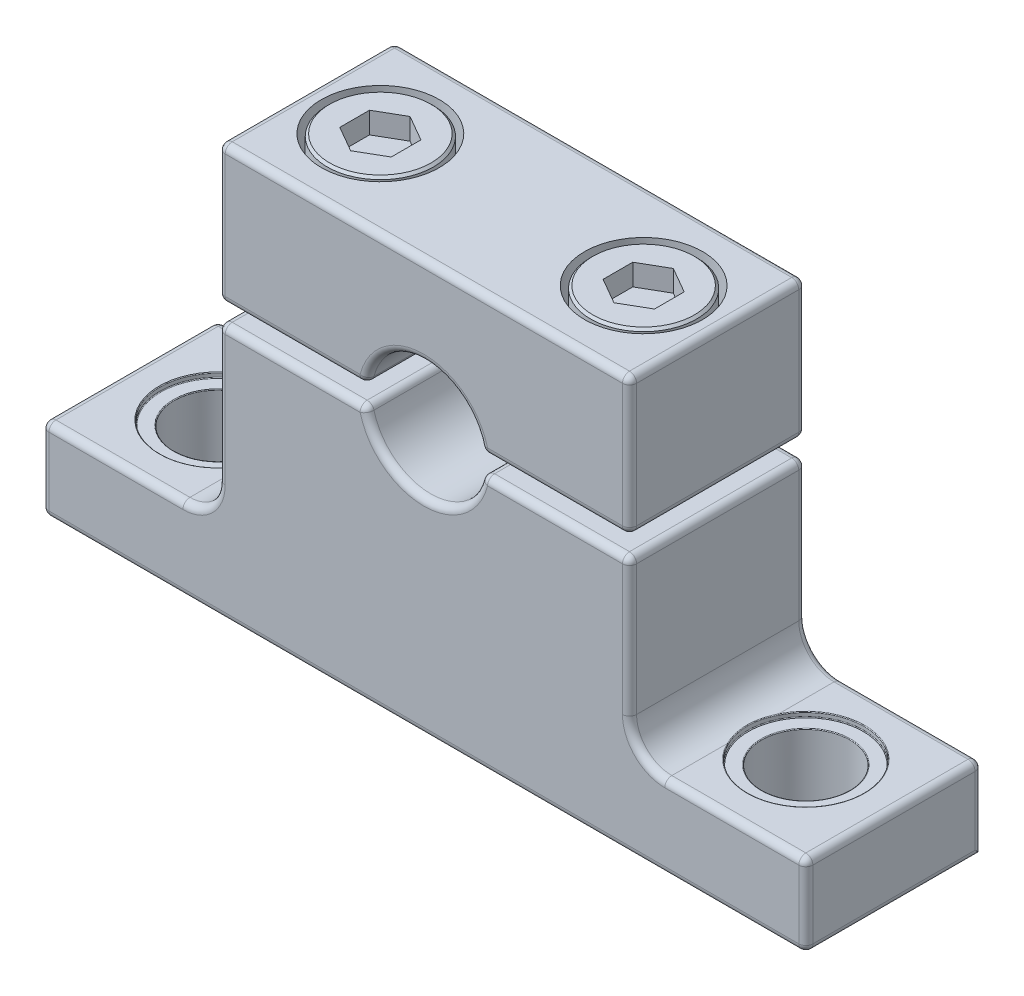
from build123d import *

# Parameters (mm, degrees)
BOSS_EXTRUDE1_DEPTH   = 9.525
BOSS_EXTRUDE1_2_DEPTH = 9.525
SKETCH4_R             = 2.38125
CUT_EXTRUDE1_DEPTH    = 32.789662726
SKETCH8_R             = 3.14325
CUT_EXTRUDE3_DEPTH    = 9.5885
SKETCH10_R            = 2.0066
CUT_EXTRUDE4_DEPTH    = 32.789662756
SKETCH12_R            = 3.1877
CUT_EXTRUDE5_DEPTH    = 3.8862
CHAMFER1_SIZE         = 0.127
CUT_EXTRUDE6_DEPTH    = 1.156716
FILLET1_R             = 0.381
FILLET2_R             = 0.381
FILLET3_R             = 0.0381


with BuildPart() as part:
    # Sketch3 → Boss-Extrude1 (new body)
    with BuildSketch(Plane.XY):
        with BuildLine():
            Line((-11.1125, 22.225), (11.1125, 22.225))
            Line((11.1125, 22.225), (11.1125, 14.7955))
            Line((11.1125, 14.7955), (3.134096521, 14.7955))
            ThreePointArc((3.134096521, 14.7955), (0, 17.4625), (-3.134096521, 14.7955))
            Line((-3.134096521, 14.7955), (-11.1125, 14.7955))
            Line((-11.1125, 14.7955), (-11.1125, 22.225))
        make_face()
    extrude(amount=-BOSS_EXTRUDE1_DEPTH)


with BuildPart() as body_2:
    # Sketch3 → Boss-Extrude1 2 (new body)
    with BuildSketch(Plane.XY):
        with BuildLine():
            Line((-11.1125, 13.7795), (-11.1125, 6.35))
            ThreePointArc((-11.1125, 6.35), (-11.670461582, 5.002961582), (-13.0175, 4.445))
            Line((-13.0175, 4.445), (-20.6375, 4.445))
            Line((-20.6375, 4.445), (-20.6375, 0))
            Line((-20.6375, 0), (20.6375, 0))
            Line((20.6375, 0), (20.6375, 4.445))
            Line((20.6375, 4.445), (13.0175, 4.445))
            ThreePointArc((13.0175, 4.445), (11.670461582, 5.002961582), (11.1125, 6.35))
            Line((11.1125, 6.35), (11.1125, 13.7795))
            Line((11.1125, 13.7795), (3.134096521, 13.7795))
            ThreePointArc((3.134096521, 13.7795), (0, 11.1125), (-3.134096521, 13.7795))
            Line((-3.134096521, 13.7795), (-11.1125, 13.7795))
        make_face()
    extrude(amount=-BOSS_EXTRUDE1_2_DEPTH)

    # Sketch4 → Cut-Extrude1 (cut, through all)
    with BuildSketch(Plane.XZ):
        with Locations((-15.875, -4.7625)):
            Circle(SKETCH4_R)
        with Locations(Location((15.875, -4.7625, 0), (0, 0, 180))):
            Circle(SKETCH4_R)
    extrude(amount=-CUT_EXTRUDE1_DEPTH, mode=Mode.SUBTRACT)

    # Sketch8 → Cut-Extrude3 (cut)
    with BuildSketch(Plane(origin=(0, 13.7795, 0), x_dir=(1, 0, 0), z_dir=(0, 1, 0))):
        with Locations(Location((-15.875, 4.7625, 0), (0, 0, 180))):
            Circle(SKETCH8_R)
        with Locations(Location((15.875, 4.7625, 0), (0, 0, 155.380022671))):
            Circle(SKETCH8_R)
    extrude(amount=-CUT_EXTRUDE3_DEPTH, mode=Mode.SUBTRACT)


with BuildPart() as cut_extrude4_tool:
    # Sketch10 → Cut-Extrude4 (new, through all)
    with BuildSketch(Plane(origin=(0, 22.225, 0), x_dir=(1, 0, 0), z_dir=(0, 1, 0))):
        with Locations(Location((7.112, 4.7625, 0), (0, 0, 180))):
            Circle(SKETCH10_R)
        with Locations(Location((-7.112, 4.7625, 0), (0, 0, 180))):
            Circle(SKETCH10_R)
    extrude(amount=-CUT_EXTRUDE4_DEPTH)


with BuildPart() as part_1:
    add(part.part)

    # Cut-Extrude4: cut by cut_extrude4_tool
    add(cut_extrude4_tool.part, mode=Mode.SUBTRACT)

    # Sketch12 → Cut-Extrude5 (cut)
    with BuildSketch(Plane(origin=(0, 22.225, 0), x_dir=(1, 0, 0), z_dir=(0, 1, 0))):
        with Locations(Location((7.112, 4.7625, 0), (0, 0, 180))):
            Circle(SKETCH12_R)
        with Locations(Location((-7.112, 4.7625, 0), (0, 0, 180))):
            Circle(SKETCH12_R)
    extrude(amount=-CUT_EXTRUDE5_DEPTH, mode=Mode.SUBTRACT)

    # Fillet1
    fillet1_edges = [part_1.edges().sort_by_distance(p)[0] for p in [
        (0, 17.4625, -9.525),
        (-11.1125, 22.225, -4.7625),
        (11.1125, 22.225, -4.7625),
        (11.1125, 14.7955, -4.7625),
        (3.134096521, 14.7955, -4.7625),
        (-3.134096521, 14.7955, -4.7625),
        (-11.1125, 14.7955, -4.7625),
        (7.12329826, 14.7955, -9.525),
        (11.1125, 18.51025, -9.525),
        (0, 22.225, -9.525),
        (-11.1125, 18.51025, -9.525),
        (0, 22.225, 0),
        (11.1125, 18.51025, 0),
        (7.12329826, 14.7955, 0),
        (-7.12329826, 14.7955, -9.525),
        (0, 17.4625, 0),
        (-7.12329826, 14.7955, 0),
        (-11.1125, 18.51025, 0),
    ]]
    fillet(fillet1_edges, radius=FILLET1_R)


with BuildPart() as body_2_1:
    add(body_2.part)

    # Cut-Extrude4: cut by cut_extrude4_tool
    add(cut_extrude4_tool.part, mode=Mode.SUBTRACT)

    # Fillet2
    fillet2_edges = [body_2_1.edges().sort_by_distance(p)[0] for p in [
        (-11.670461582, 5.002961582, -9.525),
        (0, 11.1125, 0),
        (7.12329826, 13.7795, 0),
        (11.1125, 10.06475, 0),
        (11.670461582, 5.002961582, 0),
        (16.8275, 4.445, 0),
        (20.6375, 2.2225, 0),
        (-16.8275, 4.445, -9.525),
        (0, 0, 0),
        (-20.6375, 2.2225, 0),
        (-16.8275, 4.445, 0),
        (-11.670461582, 5.002961582, 0),
        (-11.1125, 10.06475, 0),
        (-7.12329826, 13.7795, 0),
        (-20.6375, 2.2225, -9.525),
        (-3.134096521, 13.7795, -4.7625),
        (3.134096521, 13.7795, -4.7625),
        (11.1125, 13.7795, -4.7625),
        (20.6375, 4.445, -4.7625),
        (20.6375, 0, -4.7625),
        (-20.6375, 0, -4.7625),
        (-20.6375, 4.445, -4.7625),
        (-11.1125, 13.7795, -4.7625),
        (20.6375, 2.2225, -9.525),
        (16.8275, 4.445, -9.525),
        (11.670461582, 5.002961582, -9.525),
        (11.1125, 10.06475, -9.525),
        (7.12329826, 13.7795, -9.525),
        (0, 11.1125, -9.525),
        (-7.12329826, 13.7795, -9.525),
        (-11.1125, 10.06475, -9.525),
    ]]
    fillet(fillet2_edges, radius=FILLET2_R)

    # Fillet3
    fillet3_edges = [body_2_1.edges().sort_by_distance(p)[0] for p in [
        (-12.73175, 4.466553176, -4.7625),
        (-16.545143152, 4.445, -1.691518281),
        (-12.73175, 4.191, -4.7625),
        (-18.25625, 4.191, -4.7625),
        (19.01825, 4.445, -4.7625),
        (12.73175, 4.466553176, -4.7625),
        (18.25625, 4.191, -4.7625),
        (18.7325, 4.191, -3.453028995),
    ]]
    fillet(fillet3_edges, radius=FILLET3_R)


with BuildPart() as body_3:
    # Sketch15 → Revolve1 (revolve)
    with BuildSketch(Plane.XY.offset(-4.7625), mode=Mode.PRIVATE) as revolve1_sk:
        Polygon((-7.112, 4.191), (-7.112, 22.225), (-9.9822, 22.225), (-9.9822, 18.7198), (-8.8646, 18.7198), (-8.8646, 4.191), align=None)
    revolve(revolve1_sk.sketch.rotate(Axis((-7.112, 4.191, -4.7625), (0, 1, 0)), 180), axis=Axis((-7.112, 4.191, -4.7625), (0, 1, 0)))

    # Chamfer1
    chamfer1_edges = [body_3.edges().sort_by_distance(p)[0] for p in [
        (-9.9822, 22.225, -4.7625),
    ]]
    chamfer(chamfer1_edges, length=CHAMFER1_SIZE)

    # Sketch16 → Cut-Extrude6 (cut)
    with BuildSketch(Plane(origin=(0, 22.225, 0), x_dir=(1, 0, 0), z_dir=(0, 1, 0))):
        Polygon((-7.112, 6.366451217), (-8.5010625, 5.564475608), (-8.5010625, 3.960524392), (-7.112, 3.158548783), (-5.7229375, 3.960524392), (-5.7229375, 5.564475608), align=None)
    extrude(amount=-CUT_EXTRUDE6_DEPTH, mode=Mode.SUBTRACT)


with BuildPart() as body_4:
    # Mirror1: mirrored copy
    add(body_3.part.mirror(Plane(origin=(0, 0, 0), x_dir=(0, 0, 1), z_dir=(1, 0, 0))))


solid = Compound([part_1.part, body_2_1.part, body_3.part, body_4.part])
